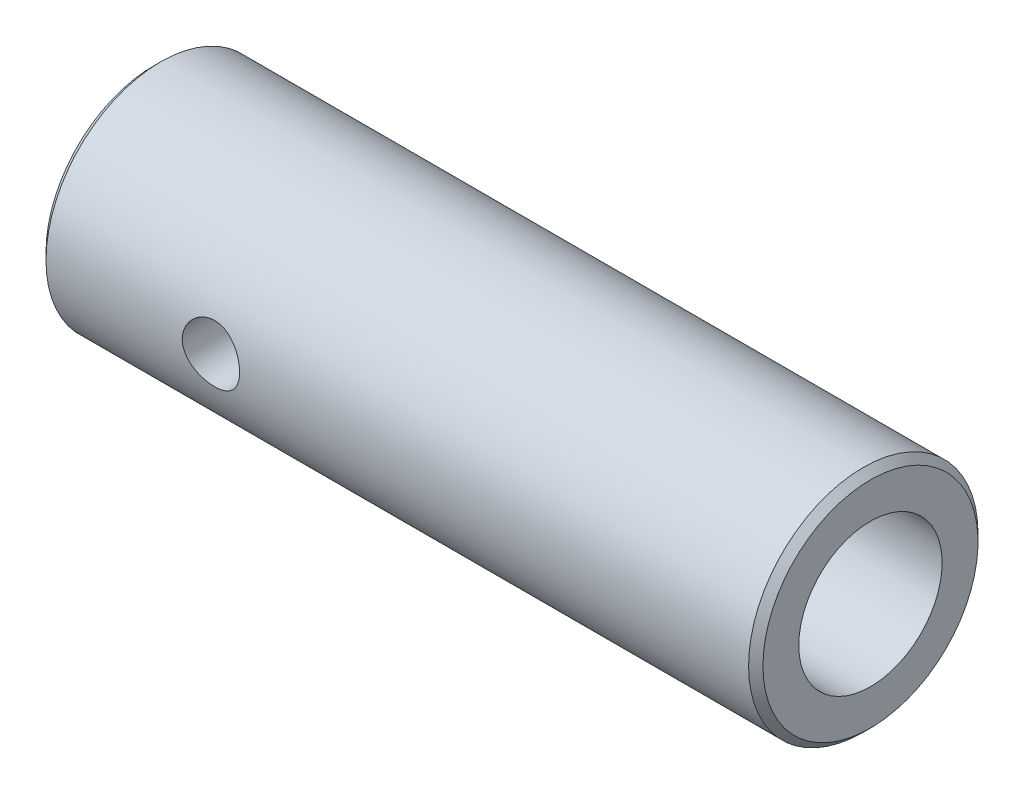
from build123d import *

# Parameters (mm, degrees)
ESQUISSE2_R             = 2
ENL_V_MAT_EXTRU_1_DEPTH = 12.5


with BuildPart() as part:
    # Esquisse1 → Base-Révolution (revolve)
    with BuildSketch(Plane.XY):
        Polygon((-0.5, 8), (0, 7.5), (0, 5), (-50, 5), (-50, 7.5), (-49.5, 8), align=None)
    revolve(axis=Axis((-22.885527638, 0, 0), (1, 0, 0)))

    # Esquisse2 → Enlèv. mat.-Extru.1 (cut, symmetric)
    with BuildSketch(Plane.XY):
        with Locations((-38, 0)):
            Circle(ESQUISSE2_R)
    extrude(amount=ENL_V_MAT_EXTRU_1_DEPTH, both=True, mode=Mode.SUBTRACT)


solid = part.part
